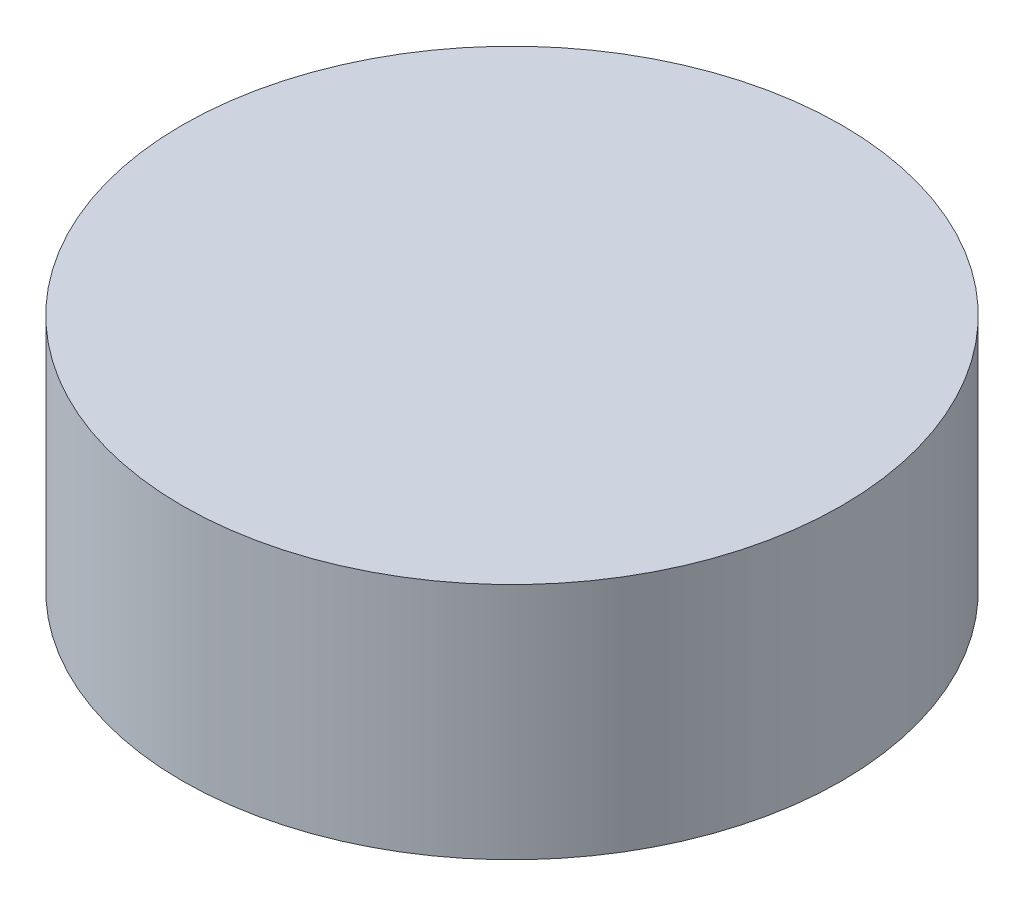
from build123d import *

# Parameters (mm, degrees)
BOSS_EXTRUDE2_DEPTH      = 2
BOSS_EXTRUDE2_DEPTH_BACK = 7
SKETCH2_R                = 12.45
SKETCH3_R                = 1.475
CUT_EXTRUDE1_DEPTH       = 6.05
SKETCH4_R                = 7
CUT_EXTRUDE2_DEPTH       = 4.05


with BuildPart() as part:
    # Sketch2 → Boss-Extrude2 (new, two sides: drawn at the far end of the back side and taken through both)
    with BuildSketch(Plane(origin=(0, 14, 0), x_dir=(1, 0, 0), z_dir=(0, 1, 0)).offset(-BOSS_EXTRUDE2_DEPTH_BACK)):
        with Locations(Location((-0.498, 0, 0), (0, 0, 270))):
            Circle(SKETCH2_R)
    extrude(amount=BOSS_EXTRUDE2_DEPTH + BOSS_EXTRUDE2_DEPTH_BACK)

    # Sketch3 → Cut-Extrude1 (cut)
    with BuildSketch(Plane.XZ.offset(-7)):
        with Locations(Location((9.5, 0, 0), (0, 0, 270))):
            Circle(SKETCH3_R)
        with Locations(Location((4.5, -8.660254038, 0), (0, 0, 270))):
            Circle(SKETCH3_R)
        with Locations(Location((-5.5, -8.660254038, 0), (0, 0, 270))):
            Circle(SKETCH3_R)
        with Locations(Location((-10.5, 0, 0), (0, 0, 270))):
            Circle(SKETCH3_R)
        with Locations(Location((-5.5, 8.660254038, 0), (0, 0, 270))):
            Circle(SKETCH3_R)
        with Locations(Location((4.5, 8.660254038, 0), (0, 0, 270))):
            Circle(SKETCH3_R)
    extrude(amount=-CUT_EXTRUDE1_DEPTH, mode=Mode.SUBTRACT)

    # Sketch4 → Cut-Extrude2 (cut)
    with BuildSketch(Plane.XZ.offset(-7)):
        with Locations(Location((-0.5, 0, 0), (0, 0, 270))):
            Circle(SKETCH4_R)
    extrude(amount=-CUT_EXTRUDE2_DEPTH, mode=Mode.SUBTRACT)


solid = part.part
